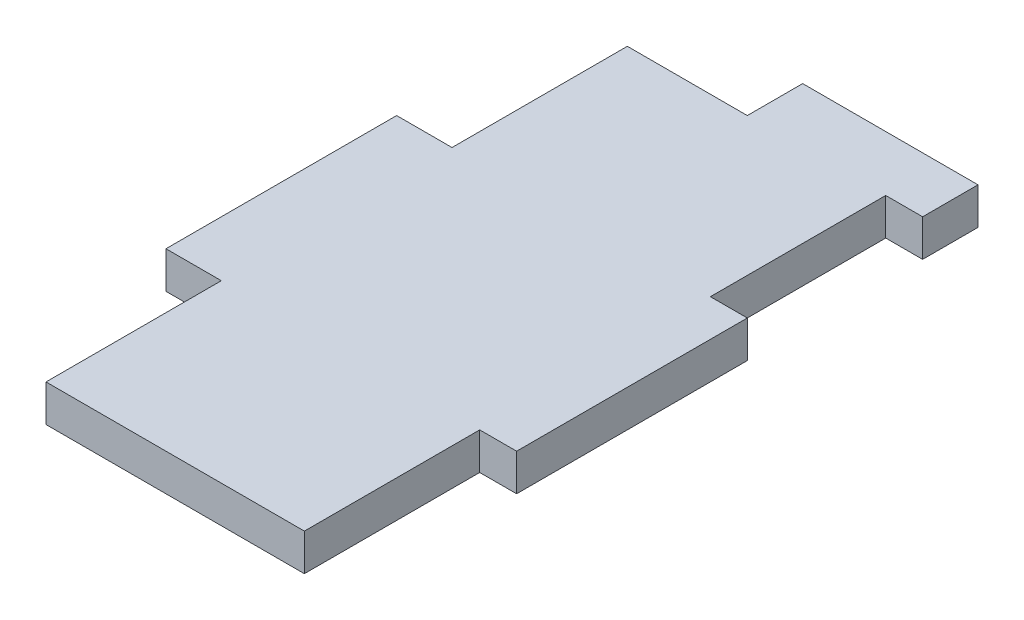
from build123d import *

# Parameters (mm, degrees)
SKETCH1_W           = 38
SKETCH1_H           = 75
BOSS_EXTRUDE1_DEPTH = 4
SKETCH2_W           = 4
SKETCH2_H           = 19
CUT_EXTRUDE1_DEPTH  = 85.172442046


with BuildPart() as part:
    # Sketch1 → Boss-Extrude1 (new body)
    with BuildSketch(Plane(origin=(0, 0, 0), x_dir=(1, 0, 0), z_dir=(0, 1, 0))):
        with Locations((19, 37.5)):
            Rectangle(SKETCH1_W, SKETCH1_H)
    extrude(amount=BOSS_EXTRUDE1_DEPTH)

    # Sketch2 → Cut-Extrude1 (cut, through all)
    with BuildSketch(Plane(origin=(0, 4, 0), x_dir=(1, 0, 0), z_dir=(0, 1, 0))):
        Polygon((0, 0), (38, 0), (38, 25), (34, 25), (34, 6), (6, 6), (6, 25), (0, 25), align=None)
        Polygon((0, 50), (6, 50), (6, 69), (19, 69), (19, 75), (0, 75), align=None)
        with Locations((36, 59.5)):
            Rectangle(SKETCH2_W, SKETCH2_H)
    extrude(amount=-CUT_EXTRUDE1_DEPTH, mode=Mode.SUBTRACT)


solid = part.part
